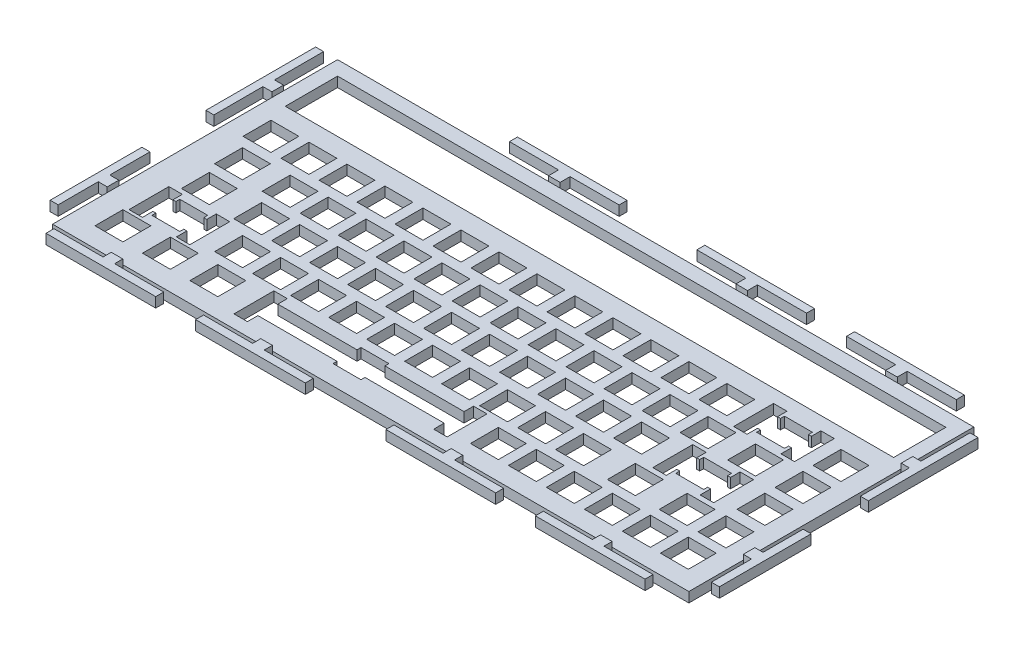
from build123d import *

# Parameters (mm, degrees)
SKETCH1_W           = 319
SKETCH1_H           = 142.875
SKETCH1_W_2         = 14
SKETCH1_H_2         = 14
SKETCH1_W_3         = 305
SKETCH1_H_3         = 26.2
BOSS_EXTRUDE2_DEPTH = 2.5
BOSS_EXTRUDE3_DEPTH = 2.5


with BuildPart() as part:
    # Sketch1 → Boss-Extrude2 (new, symmetric)
    with BuildSketch(Plane(origin=(0, 0, 0), x_dir=(1, 0, 0), z_dir=(0, 1, 0))):
        with Locations((55.078496059, 23.552072889)):
            Rectangle(SKETCH1_W, SKETCH1_H)
        with Locations((-68.754503941, 44.995572889)):
            Rectangle(SKETCH1_W_2, SKETCH1_H_2, mode=Mode.SUBTRACT)
        with Locations((-87.826503941, 44.995572889)):
            Rectangle(SKETCH1_W_2, SKETCH1_H_2, mode=Mode.SUBTRACT)
        with Locations((140.749496059, 44.995572889)):
            Rectangle(SKETCH1_W_2, SKETCH1_H_2, mode=Mode.SUBTRACT)
        with Locations((-30.654503941, 44.995572889)):
            Rectangle(SKETCH1_W_2, SKETCH1_H_2, mode=Mode.SUBTRACT)
        with Locations((-49.704503941, 44.995572889)):
            Rectangle(SKETCH1_W_2, SKETCH1_H_2, mode=Mode.SUBTRACT)
        with Locations((7.445496059, 44.995572889)):
            Rectangle(SKETCH1_W_2, SKETCH1_H_2, mode=Mode.SUBTRACT)
        with Locations((-11.604503941, 44.995572889)):
            Rectangle(SKETCH1_W_2, SKETCH1_H_2, mode=Mode.SUBTRACT)
        with Locations((45.545496059, 44.995572889)):
            Rectangle(SKETCH1_W_2, SKETCH1_H_2, mode=Mode.SUBTRACT)
        with Locations((26.495496059, 44.995572889)):
            Rectangle(SKETCH1_W_2, SKETCH1_H_2, mode=Mode.SUBTRACT)
        with Locations((174.183496059, 25.945572889)):
            Rectangle(SKETCH1_W_2, SKETCH1_H_2, mode=Mode.SUBTRACT)
        with Locations((83.645496059, 44.995572889)):
            Rectangle(SKETCH1_W_2, SKETCH1_H_2, mode=Mode.SUBTRACT)
        with Locations((64.595496059, 44.995572889)):
            Rectangle(SKETCH1_W_2, SKETCH1_H_2, mode=Mode.SUBTRACT)
        with Locations((121.722496059, 44.995572889)):
            Rectangle(SKETCH1_W_2, SKETCH1_H_2, mode=Mode.SUBTRACT)
        with Locations((102.695496059, 44.995572889)):
            Rectangle(SKETCH1_W_2, SKETCH1_H_2, mode=Mode.SUBTRACT)
        Polygon((162.399496059, 52.245572889), (176.399496059, 52.245572889), (176.399496059, 50.245572889), (177.899496059, 50.245572889), (177.899496059, 54.995572889), (184.649496059, 54.995572889), (184.649496059, 34.995572889), (177.899496059, 34.995572889), (177.899496059, 40.245572889), (176.399496059, 40.245572889), (176.399496059, 38.245572889), (162.399496059, 38.245572889), (162.399496059, 40.245572889), (160.899496059, 40.245572889), (160.899496059, 34.995572889), (154.149496059, 34.995572889), (154.149496059, 54.995572889), (160.899496059, 54.995572889), (160.899496059, 50.245572889), (162.399496059, 50.245572889), align=None, mode=Mode.SUBTRACT)
        with Locations((-40.126503941, 25.945572889)):
            Rectangle(SKETCH1_W_2, SKETCH1_H_2, mode=Mode.SUBTRACT)
        with Locations((-59.176503941, 25.945572889)):
            Rectangle(SKETCH1_W_2, SKETCH1_H_2, mode=Mode.SUBTRACT)
        with Locations((-2.051503941, 25.945572889)):
            Rectangle(SKETCH1_W_2, SKETCH1_H_2, mode=Mode.SUBTRACT)
        with Locations((-21.076503941, 25.945572889)):
            Rectangle(SKETCH1_W_2, SKETCH1_H_2, mode=Mode.SUBTRACT)
        with Locations((36.073496059, 25.945572889)):
            Rectangle(SKETCH1_W_2, SKETCH1_H_2, mode=Mode.SUBTRACT)
        with Locations((16.948496059, 25.945572889)):
            Rectangle(SKETCH1_W_2, SKETCH1_H_2, mode=Mode.SUBTRACT)
        with Locations((74.148496059, 25.945572889)):
            Rectangle(SKETCH1_W_2, SKETCH1_H_2, mode=Mode.SUBTRACT)
        with Locations((55.123496059, 25.945572889)):
            Rectangle(SKETCH1_W_2, SKETCH1_H_2, mode=Mode.SUBTRACT)
        Polygon((159.986496059, 14.145572889), (173.986496059, 14.145572889), (173.986496059, 12.145572889), (175.486496059, 12.145572889), (175.486496059, 16.895572889), (182.236496059, 16.895572889), (182.236496059, -3.104427111), (175.486496059, -3.104427111), (175.486496059, 2.145572889), (173.986496059, 2.145572889), (173.986496059, 0.145572889), (159.986496059, 0.145572889), (159.986496059, 2.145572889), (158.486496059, 2.145572889), (158.486496059, -3.104427111), (151.736496059, -3.104427111), (151.736496059, 16.895572889), (158.486496059, 16.895572889), (158.486496059, 12.145572889), (159.986496059, 12.145572889), align=None, mode=Mode.SUBTRACT)
        with Locations((-35.363503941, 6.895572889)):
            Rectangle(SKETCH1_W_2, SKETCH1_H_2, mode=Mode.SUBTRACT)
        with Locations((-54.413503941, 6.895572889)):
            Rectangle(SKETCH1_W_2, SKETCH1_H_2, mode=Mode.SUBTRACT)
        with Locations((112.273496059, 25.945572889)):
            Rectangle(SKETCH1_W_2, SKETCH1_H_2, mode=Mode.SUBTRACT)
        with Locations((93.223496059, 25.945572889)):
            Rectangle(SKETCH1_W_2, SKETCH1_H_2, mode=Mode.SUBTRACT)
        with Locations((-83.063503941, 25.945572889)):
            Rectangle(SKETCH1_W_2, SKETCH1_H_2, mode=Mode.SUBTRACT)
        with Locations((131.323496059, 25.945572889)):
            Rectangle(SKETCH1_W_2, SKETCH1_H_2, mode=Mode.SUBTRACT)
        with Locations((150.373496059, 25.945572889)):
            Rectangle(SKETCH1_W_2, SKETCH1_H_2, mode=Mode.SUBTRACT)
        with Locations((2.736496059, 6.895572889)):
            Rectangle(SKETCH1_W_2, SKETCH1_H_2, mode=Mode.SUBTRACT)
        with Locations((-16.313503941, 6.895572889)):
            Rectangle(SKETCH1_W_2, SKETCH1_H_2, mode=Mode.SUBTRACT)
        with Locations((40.836496059, 6.895572889)):
            Rectangle(SKETCH1_W_2, SKETCH1_H_2, mode=Mode.SUBTRACT)
        with Locations((21.786496059, 6.895572889)):
            Rectangle(SKETCH1_W_2, SKETCH1_H_2, mode=Mode.SUBTRACT)
        with Locations((78.936496059, 6.895572889)):
            Rectangle(SKETCH1_W_2, SKETCH1_H_2, mode=Mode.SUBTRACT)
        with Locations((59.886496059, 6.895572889)):
            Rectangle(SKETCH1_W_2, SKETCH1_H_2, mode=Mode.SUBTRACT)
        with Locations((117.036496059, 6.895572889)):
            Rectangle(SKETCH1_W_2, SKETCH1_H_2, mode=Mode.SUBTRACT)
        with Locations((97.986496059, 6.895572889)):
            Rectangle(SKETCH1_W_2, SKETCH1_H_2, mode=Mode.SUBTRACT)
        with Locations((-80.607503941, 6.895572889)):
            Rectangle(SKETCH1_W_2, SKETCH1_H_2, mode=Mode.SUBTRACT)
        with Locations((136.086496059, 6.895572889)):
            Rectangle(SKETCH1_W_2, SKETCH1_H_2, mode=Mode.SUBTRACT)
        with Locations((-25.838503941, -12.154427111)):
            Rectangle(SKETCH1_W_2, SKETCH1_H_2, mode=Mode.SUBTRACT)
        with Locations((-44.888503941, -12.154427111)):
            Rectangle(SKETCH1_W_2, SKETCH1_H_2, mode=Mode.SUBTRACT)
        with Locations((12.261496059, -12.154427111)):
            Rectangle(SKETCH1_W_2, SKETCH1_H_2, mode=Mode.SUBTRACT)
        with Locations((-6.788503941, -12.154427111)):
            Rectangle(SKETCH1_W_2, SKETCH1_H_2, mode=Mode.SUBTRACT)
        with Locations((50.361496059, -12.154427111)):
            Rectangle(SKETCH1_W_2, SKETCH1_H_2, mode=Mode.SUBTRACT)
        with Locations((31.311496059, -12.154427111)):
            Rectangle(SKETCH1_W_2, SKETCH1_H_2, mode=Mode.SUBTRACT)
        with Locations((88.461496059, -12.654427111)):
            Rectangle(SKETCH1_W_2, SKETCH1_H_2, mode=Mode.SUBTRACT)
        with Locations((69.411496059, -12.654427111)):
            Rectangle(SKETCH1_W_2, SKETCH1_H_2, mode=Mode.SUBTRACT)
        with Locations((126.561496059, -12.654427111)):
            Rectangle(SKETCH1_W_2, SKETCH1_H_2, mode=Mode.SUBTRACT)
        with Locations((107.511496059, -12.654427111)):
            Rectangle(SKETCH1_W_2, SKETCH1_H_2, mode=Mode.SUBTRACT)
        Polygon((-83.344503941, -5.154427111), (-69.344503941, -5.154427111), (-69.344503941, -7.154427111), (-67.844503941, -7.154427111), (-67.844503941, -2.404427111), (-61.094503941, -2.404427111), (-61.094503941, -22.404427111), (-67.844503941, -22.404427111), (-67.844503941, -17.154427111), (-69.344503941, -17.154427111), (-69.344503941, -19.154427111), (-83.344503941, -19.154427111), (-83.344503941, -17.154427111), (-84.844503941, -17.154427111), (-84.844503941, -22.404427111), (-91.594503941, -22.404427111), (-91.594503941, -2.404427111), (-84.844503941, -2.404427111), (-84.844503941, -7.154427111), (-83.344503941, -7.154427111), align=None, mode=Mode.SUBTRACT)
        with Locations((152.523496059, -12.654427111)):
            Rectangle(SKETCH1_W_2, SKETCH1_H_2, mode=Mode.SUBTRACT)
        with Locations((178.485496059, -12.654427111)):
            Rectangle(SKETCH1_W_2, SKETCH1_H_2, mode=Mode.SUBTRACT)
        with Locations((55.223496059, 74.745572889)):
            Rectangle(SKETCH1_W_3, SKETCH1_H_3, mode=Mode.SUBTRACT)
        with Locations((197.995496059, 25.945572889)):
            Rectangle(SKETCH1_W_2, SKETCH1_H_2, mode=Mode.SUBTRACT)
        with Locations((197.974496059, 44.995572889)):
            Rectangle(SKETCH1_W_2, SKETCH1_H_2, mode=Mode.SUBTRACT)
        with Locations((197.942496059, 6.895572889)):
            Rectangle(SKETCH1_W_2, SKETCH1_H_2, mode=Mode.SUBTRACT)
        with Locations((197.985496059, -12.654427111)):
            Rectangle(SKETCH1_W_2, SKETCH1_H_2, mode=Mode.SUBTRACT)
        with Locations((-86.094503941, -30.954427111)):
            Rectangle(SKETCH1_W_2, SKETCH1_H_2, mode=Mode.SUBTRACT)
        with Locations((-62.294503941, -30.954427111)):
            Rectangle(SKETCH1_W_2, SKETCH1_H_2, mode=Mode.SUBTRACT)
        with Locations((-38.494503941, -30.954427111)):
            Rectangle(SKETCH1_W_2, SKETCH1_H_2, mode=Mode.SUBTRACT)
        Polygon((26.439496059, -24.114427111), (40.439496059, -24.114427111), (40.439496059, -26.114427111), (80.123496059, -26.114427111), (80.123496059, -21.364427111), (86.873496059, -21.364427111), (86.873496059, -41.364427111), (80.123496059, -41.364427111), (80.123496059, -36.114427111), (40.439496059, -36.114427111), (40.439496059, -38.114427111), (26.439496059, -38.114427111), (26.439496059, -36.114427111), (-13.244503941, -36.114427111), (-13.244503941, -41.364427111), (-19.994503941, -41.364427111), (-19.994503941, -21.364427111), (-13.244503941, -21.364427111), (-13.244503941, -26.114427111), (26.439496059, -26.114427111), align=None, mode=Mode.SUBTRACT)
        with Locations((102.543496059, -31.364427111)):
            Rectangle(SKETCH1_W_2, SKETCH1_H_2, mode=Mode.SUBTRACT)
        with Locations((121.593496059, -31.364427111)):
            Rectangle(SKETCH1_W_2, SKETCH1_H_2, mode=Mode.SUBTRACT)
        with Locations((140.643496059, -31.364427111)):
            Rectangle(SKETCH1_W_2, SKETCH1_H_2, mode=Mode.SUBTRACT)
        with Locations((159.693496059, -31.364427111)):
            Rectangle(SKETCH1_W_2, SKETCH1_H_2, mode=Mode.SUBTRACT)
        with Locations((178.743496059, -31.364427111)):
            Rectangle(SKETCH1_W_2, SKETCH1_H_2, mode=Mode.SUBTRACT)
        with Locations((197.793496059, -31.364427111)):
            Rectangle(SKETCH1_W_2, SKETCH1_H_2, mode=Mode.SUBTRACT)
    extrude(amount=BOSS_EXTRUDE2_DEPTH, both=True)

    # Sketch2 → Boss-Extrude3 (add, symmetric)
    with BuildSketch(Plane(origin=(0, 2.5, 0), x_dir=(1, 0, 0), z_dir=(0, 1, 0))):
        Polygon((214.578496059, 64.389572889), (214.578496059, 58.589572889), (218.678496059, 58.589572889), (218.678496059, 33.989572889), (222.678496059, 33.989572889), (222.678496059, 88.989572889), (218.678496059, 88.989572889), (218.678496059, 64.389572889), align=None)
        Polygon((-104.421503941, 67.889572889), (-104.421503941, 62.089572889), (-108.921503941, 62.089572889), (-108.921503941, 37.489572889), (-112.921503941, 37.489572889), (-112.921503941, 92.489572889), (-108.921503941, 92.489572889), (-108.921503941, 67.889572889), align=None)
        Polygon((-104.421503941, -14.685427111), (-104.421503941, -20.485427111), (-108.921503941, -20.485427111), (-108.921503941, -40.585427111), (-112.921503941, -40.585427111), (-112.921503941, 5.414572889), (-108.921503941, 5.414572889), (-108.921503941, -14.685427111), align=None)
        Polygon((1.358496059, 94.989572889), (7.158496059, 94.989572889), (7.158496059, 99.989572889), (31.758496059, 99.989572889), (31.758496059, 103.989572889), (-23.241503941, 103.989572889), (-23.241503941, 99.989572889), (1.358496059, 99.989572889), align=None)
        Polygon((-75.021503941, -47.885427111), (-69.221503941, -47.885427111), (-69.221503941, -51.985427111), (-44.621503941, -51.985427111), (-44.621503941, -55.985427111), (-99.621503941, -55.985427111), (-99.621503941, -51.985427111), (-75.021503941, -51.985427111), align=None)
        Polygon((-0.021503941, -47.885427111), (5.778496059, -47.885427111), (5.778496059, -51.985427111), (30.378496059, -51.985427111), (30.378496059, -55.985427111), (-24.621503941, -55.985427111), (-24.621503941, -51.985427111), (-0.021503941, -51.985427111), align=None)
        Polygon((95.428496059, -47.885427111), (101.228496059, -47.885427111), (101.228496059, -51.985427111), (125.828496059, -51.985427111), (125.828496059, -55.985427111), (70.828496059, -55.985427111), (70.828496059, -51.985427111), (95.428496059, -51.985427111), align=None)
        Polygon((170.328496059, -47.885427111), (176.128496059, -47.885427111), (176.128496059, -51.985427111), (200.728496059, -51.985427111), (200.728496059, -55.985427111), (145.728496059, -55.985427111), (145.728496059, -51.985427111), (170.328496059, -51.985427111), align=None)
        Polygon((95.314498579, 94.989572889), (101.114498579, 94.989572889), (101.114498579, 99.989572889), (125.714498579, 99.989572889), (125.714498579, 103.989572889), (70.714498579, 103.989572889), (70.714498579, 99.989572889), (95.314498579, 99.989572889), align=None)
        Polygon((170.396631751, 94.989572889), (176.196631751, 94.989572889), (176.196631751, 99.989572889), (200.796631751, 99.989572889), (200.796631751, 103.989572889), (145.796631751, 103.989572889), (145.796631751, 99.989572889), (170.396631751, 99.989572889), align=None)
        Polygon((214.578496059, -14.785427111), (214.578496059, -20.585427111), (218.678496059, -20.585427111), (218.678496059, -40.685427111), (222.678496059, -40.685427111), (222.678496059, 5.314572889), (218.678496059, 5.314572889), (218.678496059, -14.785427111), align=None)
    extrude(amount=BOSS_EXTRUDE3_DEPTH, both=True)


solid = part.part
